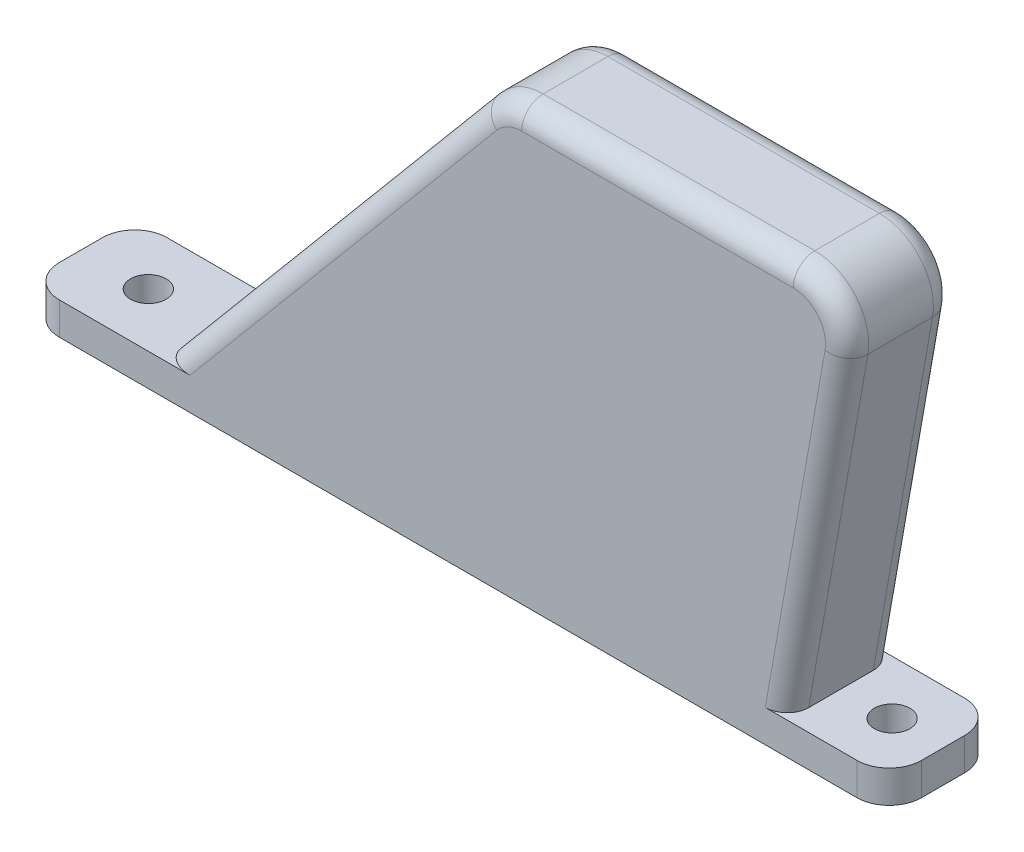
from build123d import *

# Parameters (mm, degrees)
BOSS_EXTRUDE1_DEPTH = 10
BOSS_EXTRUDE2_DEPTH = 3
FILLET2_R           = 3
SKETCH3_R           = 1.65
CUT_EXTRUDE2_DEPTH  = 80.806014811
FILLET4_R           = 5
FILLET3_R           = 2


with BuildPart() as part:
    # Sketch1 → Boss-Extrude1 (new body)
    with BuildSketch(Plane.XY):
        Polygon((0, 0), (60, 0), (67.053079228, 40), (33.563985247, 40), align=None)
    extrude(amount=BOSS_EXTRUDE1_DEPTH)

    # Sketch2 → Boss-Extrude2 (add)
    with BuildSketch(Plane.XZ):
        Polygon((0, 10), (-10, 10), (-10, 0), (0, 0), (70, 0), (70, 10), (60, 10), align=None)
    extrude(amount=-BOSS_EXTRUDE2_DEPTH)

    # Fillet2
    fillet2_edges = [part.edges().sort_by_distance(p)[0] for p in [
        (70, 1.5, 0),
        (-10, 1.5, 10),
        (70, 1.5, 10),
        (-10, 1.5, 0),
    ]]
    fillet(fillet2_edges, radius=FILLET2_R)

    # Sketch3 → Cut-Extrude2 (cut, through all)
    with BuildSketch(Plane(origin=(0, 3, 0), x_dir=(1, 0, 0), z_dir=(0, 1, 0))):
        with Locations(Location((65.264490471, -5, 0), (0, 0, 270))):
            Circle(SKETCH3_R)
        with Locations(Location((-3.741350553, -5, 0), (0, 0, 270))):
            Circle(SKETCH3_R)
    extrude(amount=-CUT_EXTRUDE2_DEPTH, mode=Mode.SUBTRACT)

    # Fillet4
    fillet4_edges = [part.edges().sort_by_distance(p)[0] for p in [
        (67.053079228, 40, 5),
        (33.563985247, 40, 5),
    ]]
    fillet(fillet4_edges, radius=FILLET4_R)

    # Fillet3
    fillet3_edges = [part.edges().sort_by_distance(p)[0] for p in [
        (63.273665486, 18.565879556, 0),
        (17.291300108, 20.606969024, 0),
        (17.291300108, 20.606969024, 10),
        (63.273665486, 18.565879556, 10),
        (48.494917402, 40, 0),
        (48.494917402, 40, 10),
        (33.782432229, 39.531538935, 0),
        (64.924533481, 38.213938048, 0),
        (33.782432229, 39.531538935, 10),
        (64.924533481, 38.213938048, 10),
    ]]
    fillet(fillet3_edges, radius=FILLET3_R)


solid = part.part
